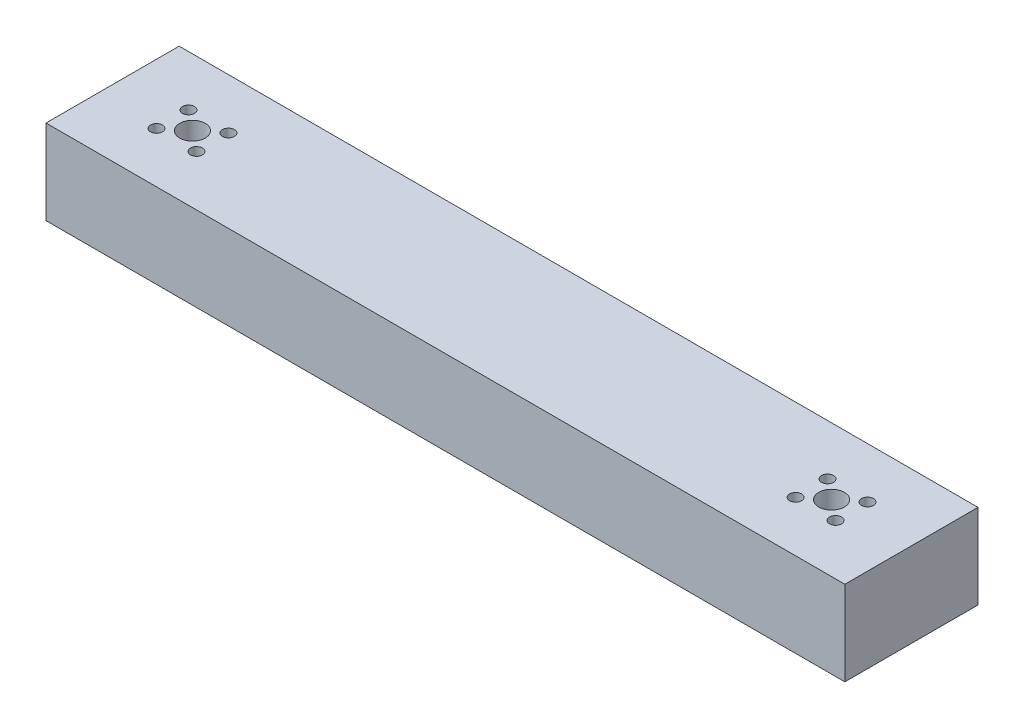
from build123d import *

# Parameters (mm, degrees)
SKETCH2_W           = 300
SKETCH2_H           = 50
BOSS_EXTRUDE1_DEPTH = 31.75
SKETCH3_R           = 4.8
SKETCH3_R_2         = 2.25
CUT_EXTRUDE1_DEPTH  = 31.75
SKETCH3_3_R         = 2.25
CUT_EXTRUDE2_DEPTH  = 31.75


with BuildPart() as part:
    # Sketch2 → Boss-Extrude1 (new body)
    with BuildSketch(Plane(origin=(0, 0, 0), x_dir=(1, 0, 0), z_dir=(0, 1, 0))):
        with Locations((150, 25)):
            Rectangle(SKETCH2_W, SKETCH2_H)
    extrude(amount=BOSS_EXTRUDE1_DEPTH)

    # Sketch3 → Cut-Extrude1 (cut)
    with BuildSketch(Plane(origin=(0, 31.75, 0), x_dir=(1, 0, 0), z_dir=(0, 1, 0))):
        with Locations((30, 25)):
            Circle(SKETCH3_R)
        with Locations((22.5, 19)):
            Circle(SKETCH3_R_2)
        with Locations((270, 25)):
            Circle(SKETCH3_R)
        with Locations((277.5, 19)):
            Circle(SKETCH3_R_2)
    extrude(amount=-CUT_EXTRUDE1_DEPTH, mode=Mode.SUBTRACT)

    # Sketch3<3> → Cut-Extrude2 (cut)
    with BuildSketch(Plane(origin=(0, 31.75, 0), x_dir=(1, 0, 0), z_dir=(0, 1, 0))):
        with Locations((37.5, 31)):
            Circle(SKETCH3_3_R)
        with Locations((37.5, 19)):
            Circle(SKETCH3_3_R)
        with Locations((22.5, 31)):
            Circle(SKETCH3_3_R)
        with Locations((277.5, 31)):
            Circle(SKETCH3_3_R)
        with Locations((262.5, 19)):
            Circle(SKETCH3_3_R)
        with Locations((262.5, 31)):
            Circle(SKETCH3_3_R)
    extrude(amount=-CUT_EXTRUDE2_DEPTH, mode=Mode.SUBTRACT)


solid = part.part
